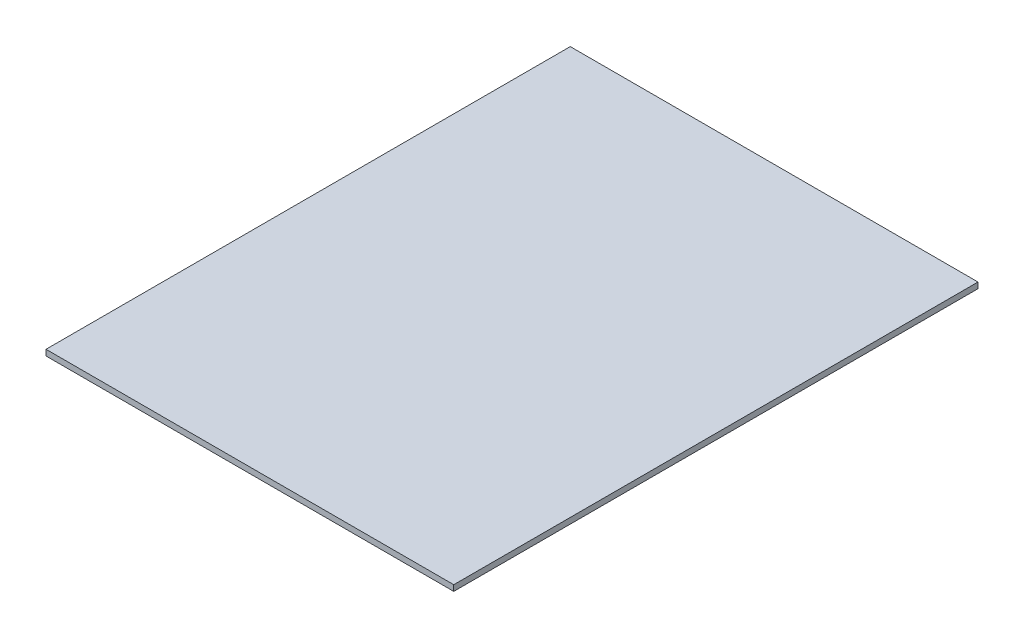
from build123d import *

# Parameters (mm, degrees)
SKETCH1_W           = 70
SKETCH1_H           = 90
BOSS_EXTRUDE1_DEPTH = 1


with BuildPart() as part:
    # Sketch1 → Boss-Extrude1 (new body)
    with BuildSketch(Plane(origin=(0, 0, 0), x_dir=(1, 0, 0), z_dir=(0, 1, 0))):
        Rectangle(SKETCH1_W, SKETCH1_H)
    extrude(amount=BOSS_EXTRUDE1_DEPTH)


solid = part.part
